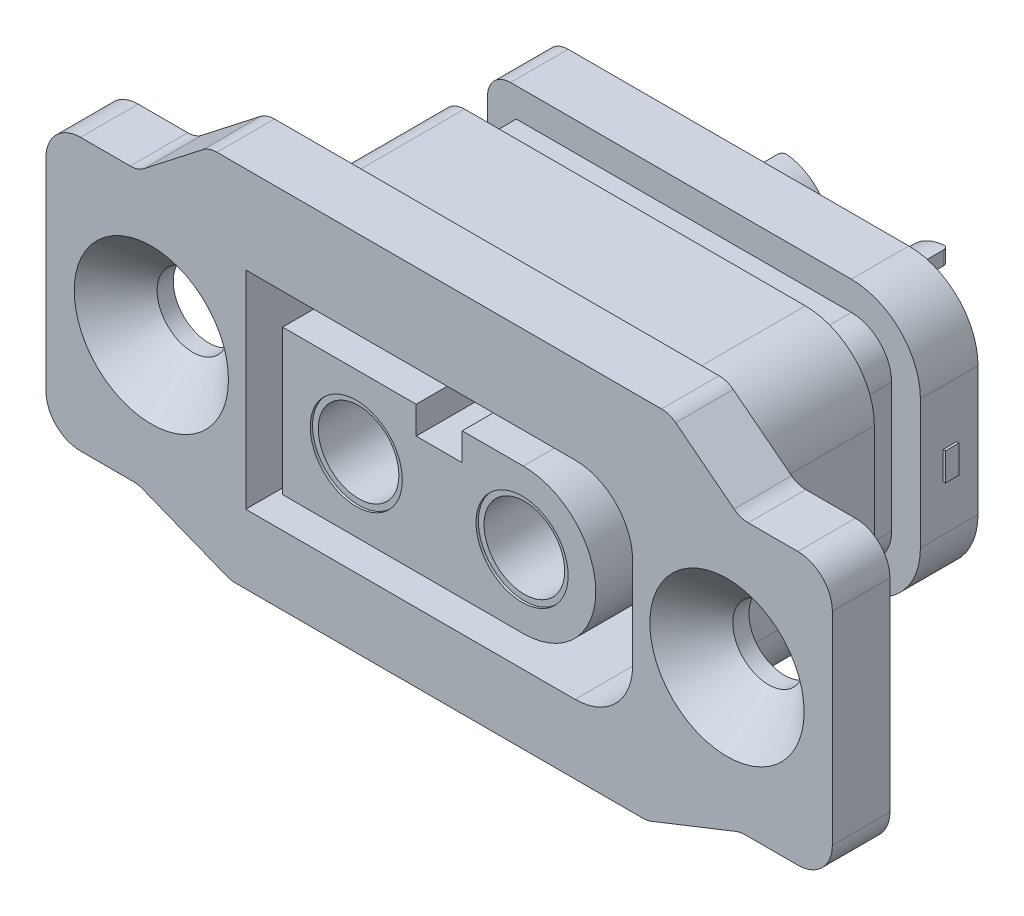
from build123d import *

# Parameters (mm, degrees)
SKETCH1_W                                            = 18.8
SKETCH1_H                                            = 11.6
BOSS_EXTRUDE1_DEPTH                                  = 11.5
SKETCH2_W                                            = 34.15
SKETCH2_H                                            = 11.8
BOSS_EXTRUDE2_DEPTH                                  = 2.5
BOSS_EXTRUDE3_DEPTH                                  = 2.5
FILLET1_R                                            = 1.5
FILLET2_R                                            = 1
CSK_FOR_M3_HEX_SOCKET_COUNTERSUNK_HEAD_S_D           = 3.1
CSK_FOR_M3_HEX_SOCKET_COUNTERSUNK_HEAD_S_CSINK_D     = 6.7
CSK_FOR_M3_HEX_SOCKET_COUNTERSUNK_HEAD_S_CSINK_ANGLE = 90
FILLET3_R                                            = 3
FILLET4_R                                            = 1
CUT_EXTRUDE1_DEPTH                                   = 2
SKETCH7_W                                            = 6.4
SKETCH7_H                                            = 6.2
CUT_EXTRUDE2_DEPTH                                   = 2
FILLET5_R                                            = 1.5
SKETCH8_R                                            = 2.1
BOSS_EXTRUDE4_DEPTH                                  = 6.5
F_3_0MM_DOWEL_HOLE1_D                                = 3
F_3_0MM_DOWEL_HOLE1_DEPTH                            = 3.3
F_3_0MM_DOWEL_HOLE1_TIP                              = 0.901290929
SKETCH11_W                                           = 3.39233295
SKETCH11_H                                           = 4.331282249
SKETCH11_W_2                                         = 2.756270522
SKETCH11_H_2                                         = 5.335422798
CUT_EXTRUDE3_DEPTH                                   = 3.25
FILLET6_R                                            = 0.2
CUT_EXTRUDE6_DEPTH                                   = 8.8
SKETCH13_R                                           = 2
CUT_EXTRUDE7_DEPTH                                   = 0.1
SKETCH14_R                                           = 1.75
CUT_EXTRUDE8_DEPTH                                   = 12
SKETCH15_W                                           = 0.583333334
SKETCH15_H                                           = 1.211538462
BOSS_EXTRUDE5_DEPTH                                  = 0.1
BOSS_EXTRUDE6_DEPTH                                  = 0.1


with BuildPart() as part:
    # Sketch1 → Boss-Extrude1 (new body)
    with BuildSketch(Plane.XY):
        Rectangle(SKETCH1_W, SKETCH1_H)
    extrude(amount=-BOSS_EXTRUDE1_DEPTH)

    # Sketch2 → Boss-Extrude2 (add)
    with BuildSketch(Plane.XY):
        Rectangle(SKETCH2_W, SKETCH2_H)
    extrude(amount=BOSS_EXTRUDE2_DEPTH)

    # Sketch3 → Boss-Extrude3 (add)
    with BuildSketch(Plane.XY):
        Polygon((-10, 8.3), (-13.075, 5.9), (-13.075, -5.9), (-9.036144578, -7.5), (9.036144578, -7.5), (13.075, -5.9), (13.075, 5.9), (10, 8.3), align=None)
    extrude(amount=BOSS_EXTRUDE3_DEPTH)

    # Fillet1
    fillet1_edges = [part.edges().sort_by_distance(p)[0] for p in [
        (-17.075, 5.9, 1.25),
        (-17.075, -5.9, 1.25),
        (17.075, -5.9, 1.25),
        (17.075, 5.9, 1.25),
    ]]
    fillet(fillet1_edges, radius=FILLET1_R)

    # Fillet2
    fillet2_edges = [part.edges().sort_by_distance(p)[0] for p in [
        (10, 8.3, 1.25),
        (-10, 8.3, 1.25),
        (-13.075, 5.9, 1.25),
        (-13.075, -5.9, 1.25),
        (-9.036144578, -7.5, 1.25),
        (9.036144578, -7.5, 1.25),
        (13.075, -5.9, 1.25),
        (13.075, 5.9, 1.25),
    ]]
    fillet(fillet2_edges, radius=FILLET2_R)

    # CSK for M3 Hex Socket Countersunk Head Screw1 (through all)
    with Locations(Plane.XY.offset(2.5)):
        with Locations((-12.5, 0), (12.5, 0)):
            CounterSinkHole(CSK_FOR_M3_HEX_SOCKET_COUNTERSUNK_HEAD_S_D / 2, CSK_FOR_M3_HEX_SOCKET_COUNTERSUNK_HEAD_S_CSINK_D / 2, counter_sink_angle=CSK_FOR_M3_HEX_SOCKET_COUNTERSUNK_HEAD_S_CSINK_ANGLE)

    # Fillet3
    fillet3_edges = [part.edges().sort_by_distance(p)[0] for p in [
        (9.4, 5.8, -5.75),
        (9.4, -5.8, -5.75),
    ]]
    fillet(fillet3_edges, radius=FILLET3_R)

    # Fillet4
    fillet4_edges = [part.edges().sort_by_distance(p)[0] for p in [
        (-9.4, 5.8, -5.75),
        (-9.4, -5.8, -5.75),
    ]]
    fillet(fillet4_edges, radius=FILLET4_R)

    # Sketch6 → Cut-Extrude1 (cut)
    with BuildSketch(Plane(origin=(0, 0, -7), x_dir=(-1, 0, 0), z_dir=(0, 0, -1))):
        with BuildLine():
            Line((-6.4, -6.7), (8.4, -6.7))
            ThreePointArc((8.4, -6.7), (9.743502884, -6.143502884), (10.3, -4.8))
            Line((10.3, -4.8), (10.3, 4.8))
            ThreePointArc((10.3, 4.8), (9.743502884, 6.143502884), (8.4, 6.7))
            Line((8.4, 6.7), (-6.4, 6.7))
            ThreePointArc((-6.4, 6.7), (-9.157716447, 5.557716447), (-10.3, 2.8))
            Line((-10.3, 2.8), (-10.3, -2.8))
            ThreePointArc((-10.3, -2.8), (-9.157716447, -5.557716447), (-6.4, -6.7))
        make_face()
        with BuildLine():
            Line((-6.4, -4.55), (8.15, -4.55))
            Line((8.15, -4.55), (8.15, 4.55))
            Line((8.15, 4.55), (-6.4, 4.55))
            ThreePointArc((-6.4, 4.55), (-7.637436867, 4.037436867), (-8.15, 2.8))
            Line((-8.15, 2.8), (-8.15, -2.8))
            ThreePointArc((-8.15, -2.8), (-7.637436867, -4.037436867), (-6.4, -4.55))
        make_face(mode=Mode.SUBTRACT)
    extrude(amount=CUT_EXTRUDE1_DEPTH, mode=Mode.SUBTRACT)

    # Sketch7 → Cut-Extrude2 (cut)
    with BuildSketch(Plane(origin=(0, 0, -11.5), x_dir=(-1, 0, 0), z_dir=(0, 0, -1))):
        with Locations((-3.5, 0)):
            Rectangle(SKETCH7_W, SKETCH7_H)
        with Locations((3.5, 0)):
            Rectangle(SKETCH7_W, SKETCH7_H)
    extrude(amount=-CUT_EXTRUDE2_DEPTH, mode=Mode.SUBTRACT)

    # Fillet5
    fillet5_edges = [part.edges().sort_by_distance(p)[0] for p in [
        (6.7, -3.1, -10.5),
        (6.7, 3.1, -10.5),
    ]]
    fillet(fillet5_edges, radius=FILLET5_R)

    # Sketch8 → Boss-Extrude4 (add)
    with BuildSketch(Plane(origin=(0, 0, -9.5), x_dir=(-1, 0, 0), z_dir=(0, 0, -1))):
        with Locations(Location((-3.6, 0, 0), (0, 0, 180))):
            Circle(SKETCH8_R)
        with Locations(Location((3.6, 0, 0), (0, 0, 180))):
            Circle(SKETCH8_R)
    extrude(amount=BOSS_EXTRUDE4_DEPTH)

    # Ø3.0mm Dowel Hole1
    with Locations(Plane(origin=(0, 0, -16), x_dir=(-1, 0, 0), z_dir=(0, 0, -1))):
        with Locations((-3.6, 0), (3.6, 0)):
            Hole(F_3_0MM_DOWEL_HOLE1_D / 2, depth=F_3_0MM_DOWEL_HOLE1_DEPTH)
            with Locations((0, 0, -(F_3_0MM_DOWEL_HOLE1_DEPTH + F_3_0MM_DOWEL_HOLE1_TIP / 2))):  # 118° drill point
                Cone(0, F_3_0MM_DOWEL_HOLE1_D / 2, F_3_0MM_DOWEL_HOLE1_TIP, mode=Mode.SUBTRACT)

    # Sketch11 → Cut-Extrude3 (cut, symmetric)
    with BuildSketch(Plane(origin=(0, 0, 0), x_dir=(1, 0, 0), z_dir=(0, 1, 0))):
        with Locations((-5.296166475, 15.165641125)):
            Rectangle(SKETCH11_W, SKETCH11_H)
        with Locations((4.978135261, 15.667711399)):
            Rectangle(SKETCH11_W_2, SKETCH11_H_2)
    extrude(amount=CUT_EXTRUDE3_DEPTH, both=True, mode=Mode.SUBTRACT)

    # Fillet6
    fillet6_edges = [part.edges().sort_by_distance(p)[0] for p in [
        (-3.6, 1.8, -13),
        (-3.6, -1.8, -13),
        (-3.6, 1.8, -16),
        (-3.6, -1.8, -16),
        (3.6, 1.8, -13),
        (3.6, -1.8, -13),
        (3.6, -1.8, -16),
        (3.6, 1.8, -16),
    ]]
    fillet(fillet6_edges, radius=FILLET6_R)

    # Sketch12 → Cut-Extrude6 (cut)
    with BuildSketch(Plane.XY.offset(2.5)):
        with BuildLine():
            Line((5.9, -4.5), (-8.4, -4.5))
            Line((-8.4, -4.5), (-8.4, 4.5))
            Line((-8.4, 4.5), (5.9, 4.5))
            ThreePointArc((5.9, 4.5), (7.667766953, 3.767766953), (8.4, 2))
            Line((8.4, 2), (8.4, -2))
            ThreePointArc((8.4, -2), (7.667766953, -3.767766953), (5.9, -4.5))
        make_face()
        with BuildLine():
            Line((3.65, -3.15), (-6.8, -3.15))
            Line((-6.8, -3.15), (-6.8, 3.15))
            Line((-6.8, 3.15), (-1, 3.15))
            Line((-1, 3.15), (-1, 1.95))
            Line((-1, 1.95), (1, 1.95))
            Line((1, 1.95), (1, 3.15))
            Line((1, 3.15), (3.65, 3.15))
            ThreePointArc((3.65, 3.15), (6.8, 0), (3.65, -3.15))
        make_face(mode=Mode.SUBTRACT)
    extrude(amount=-CUT_EXTRUDE6_DEPTH, mode=Mode.SUBTRACT)

    # Sketch13 → Cut-Extrude7 (cut)
    with BuildSketch(Plane.XY.offset(2.5)):
        with Locations((-3.6, 0)):
            Circle(SKETCH13_R)
        with Locations((3.6, 0)):
            Circle(SKETCH13_R)
    extrude(amount=-CUT_EXTRUDE7_DEPTH, mode=Mode.SUBTRACT)

    # Sketch14 → Cut-Extrude8 (cut)
    with BuildSketch(Plane.XY.offset(2.5)):
        with Locations((-3.6, 0)):
            Circle(SKETCH14_R)
        with Locations((3.6, 0)):
            Circle(SKETCH14_R)
    extrude(amount=-CUT_EXTRUDE8_DEPTH, mode=Mode.SUBTRACT)

    # Sketch15 → Boss-Extrude5 (add)
    with BuildSketch(Plane(origin=(9.4, 0, 0), x_dir=(0, 0, -1), z_dir=(1, 0, 0))):
        with Locations((10.278846154, -0.201923077)):
            Rectangle(SKETCH15_W, SKETCH15_H)
    extrude(amount=BOSS_EXTRUDE5_DEPTH)

    # Sketch16 → Boss-Extrude6 (add)
    with BuildSketch(Plane.ZY.offset(9.4)):
        Polygon((-10.560064901, -0.314102564), (-11.412629003, -0.314102564), (-11.412629003, 0.269230769), (-10.560064901, 0.269230769), (-10.560064901, 1.166666667), (-9.976731567, 1.166666667), (-9.976731567, 0.269230769), (-9.124167465, 0.269230769), (-9.124167465, -0.314102564), (-9.976731567, -0.314102564), (-9.976731567, -1.211538462), (-10.560064901, -1.211538462), align=None)
    extrude(amount=BOSS_EXTRUDE6_DEPTH)


solid = part.part
